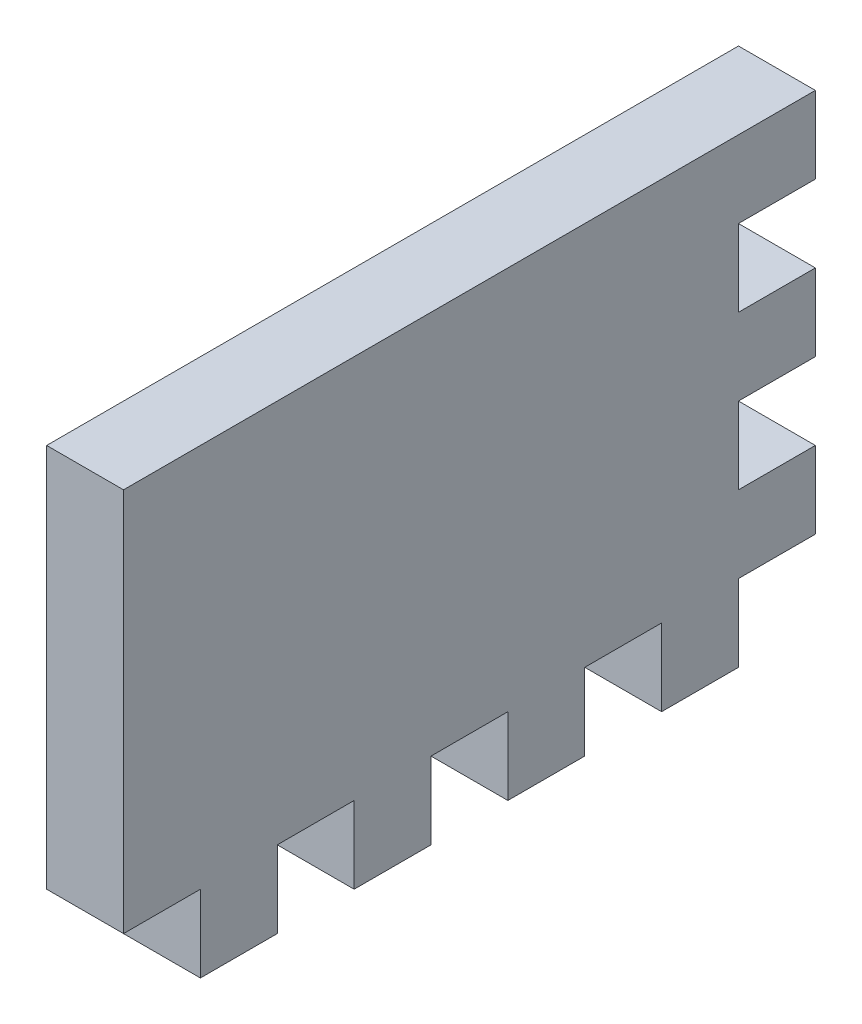
from build123d import *

# Parameters (mm, degrees)
BOSS_EXTRUDE1_DEPTH = 12.7


with BuildPart() as part:
    # Sketch1 → Boss-Extrude1 (new body)
    with BuildSketch(Plane(origin=(0, 0, 0), x_dir=(0, 0, -1), z_dir=(1, 0, 0))):
        Polygon((0, 0), (12.7, 0), (12.7, -12.7), (25.4, -12.7), (25.4, 0), (38.1, 0), (38.1, -12.7), (50.8, -12.7), (50.8, 0), (63.5, 0), (63.5, -12.7), (76.2, -12.7), (76.2, 0), (88.9, 0), (88.9, -12.7), (101.6, -12.7), (101.6, 0), (114.3, 0), (114.3, 12.7), (101.6, 12.7), (101.6, 25.4), (114.3, 25.4), (114.3, 38.1), (101.6, 38.1), (101.6, 50.8), (114.3, 50.8), (114.3, 63.5), (101.6, 63.5), (0, 63.5), align=None)
    extrude(amount=BOSS_EXTRUDE1_DEPTH)


solid = part.part
